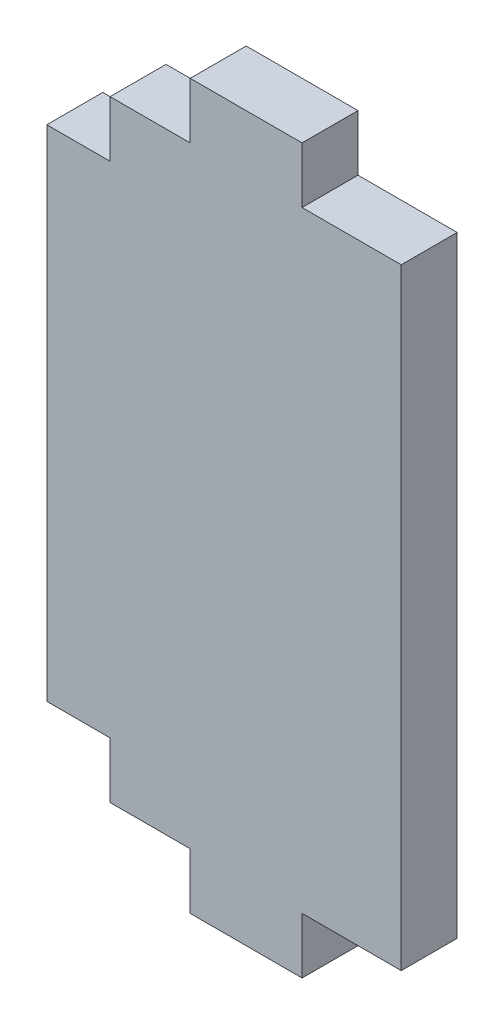
from build123d import *

# Parameters (mm, degrees)
BASE_EXTRUDE_DEPTH = 3


with BuildPart() as part:
    # Sketch1 → Base-Extrude (new body)
    with BuildSketch(Plane.XY):
        Polygon((-1235.833585259, -48.507485994), (-1235.833585259, -81.277485994), (-1241.149437105, -81.277485994), (-1241.149437105, -84.277485994), (-1247.145344684, -84.277485994), (-1247.145344684, -81.277485994), (-1251.441888482, -81.277485994), (-1251.441888482, -78.277485994), (-1254.833585259, -78.277485994), (-1254.833585259, -51.507485994), (-1251.441888482, -51.507485994), (-1251.441888482, -48.507485994), (-1247.145344684, -48.507485994), (-1247.145344684, -45.507485994), (-1241.149437105, -45.507485994), (-1241.149437105, -48.507485994), align=None)
    extrude(amount=BASE_EXTRUDE_DEPTH)


solid = part.part
